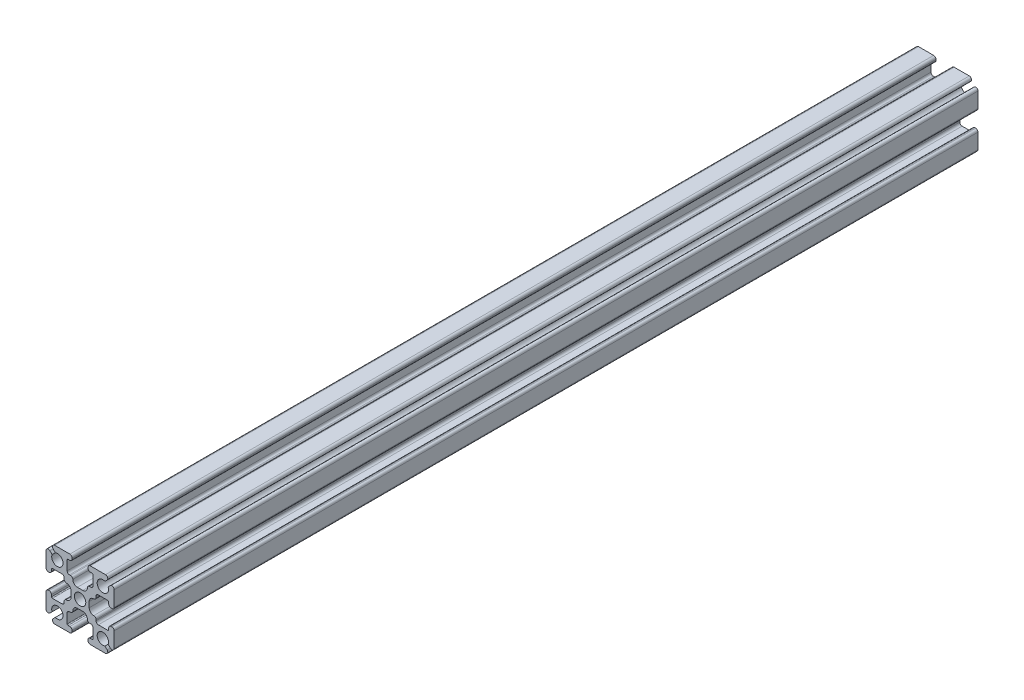
from build123d import *

# Parameters (mm, degrees)
SKETCH1_R           = 1.25
BOSS_EXTRUDE1_DEPTH = 190


with BuildPart() as part:
    # Sketch1 → Boss-Extrude1 (new body)
    with BuildSketch(Plane.XY):
        with BuildLine():
            Line((6.646446609, 5.939339828), (6.163645978, 5.456539197))
            ThreePointArc((6.163645978, 5.456539197), (4.116116524, 4.116116524), (5.456539197, 6.163645978))
            Line((5.456539197, 6.163645978), (5.939339828, 6.646446609))
            ThreePointArc((5.939339828, 6.646446609), (6.047726204, 7.191341716), (5.585786438, 7.5))
            Line((5.585786438, 7.5), (2.25, 7.5))
            ThreePointArc((2.25, 7.5), (1.896446609, 7.353553391), (1.75, 7))
            Line((1.75, 7), (1.75, 6.8))
            ThreePointArc((1.75, 6.8), (1.896446609, 6.446446609), (2.25, 6.3))
            Line((2.25, 6.3), (2.65, 6.3))
            ThreePointArc((2.65, 6.3), (2.791421356, 6.241421356), (2.85, 6.1))
            Line((2.85, 6.1), (2.85, 4))
            ThreePointArc((2.85, 4), (2.703553391, 3.646446609), (2.35, 3.5))
            Line((2.35, 3.5), (2.1, 3.5))
            ThreePointArc((2.1, 3.5), (1.746446609, 3.353553391), (1.6, 3))
            ThreePointArc((1.6, 3), (1.307106781, 2.292893219), (0.6, 2))
            Line((0.6, 2), (-0.6, 2))
            ThreePointArc((-0.6, 2), (-1.307106781, 2.292893219), (-1.6, 3))
            ThreePointArc((-1.6, 3), (-1.746446609, 3.353553391), (-2.1, 3.5))
            Line((-2.1, 3.5), (-2.35, 3.5))
            ThreePointArc((-2.35, 3.5), (-2.703553391, 3.646446609), (-2.85, 4))
            Line((-2.85, 4), (-2.85, 6.1))
            ThreePointArc((-2.85, 6.1), (-2.791421356, 6.241421356), (-2.65, 6.3))
            Line((-2.65, 6.3), (-2.25, 6.3))
            ThreePointArc((-2.25, 6.3), (-1.896446609, 6.446446609), (-1.75, 6.8))
            Line((-1.75, 6.8), (-1.75, 7))
            ThreePointArc((-1.75, 7), (-1.896446609, 7.353553391), (-2.25, 7.5))
            Line((-2.25, 7.5), (-5.585786438, 7.5))
            ThreePointArc((-5.585786438, 7.5), (-6.047726204, 7.191341716), (-5.939339828, 6.646446609))
            Line((-5.939339828, 6.646446609), (-5.456539197, 6.163645978))
            ThreePointArc((-5.456539197, 6.163645978), (-4.116116524, 4.116116524), (-6.163645978, 5.456539197))
            Line((-6.163645978, 5.456539197), (-6.646446609, 5.939339828))
            ThreePointArc((-6.646446609, 5.939339828), (-7.191341716, 6.047726204), (-7.5, 5.585786438))
            Line((-7.5, 5.585786438), (-7.5, 2.25))
            ThreePointArc((-7.5, 2.25), (-7.353553391, 1.896446609), (-7, 1.75))
            Line((-7, 1.75), (-6.8, 1.75))
            ThreePointArc((-6.8, 1.75), (-6.446446609, 1.896446609), (-6.3, 2.25))
            Line((-6.3, 2.25), (-6.3, 2.65))
            ThreePointArc((-6.3, 2.65), (-6.241421356, 2.791421356), (-6.1, 2.85))
            Line((-6.1, 2.85), (-4, 2.85))
            ThreePointArc((-4, 2.85), (-3.646446609, 2.703553391), (-3.5, 2.35))
            Line((-3.5, 2.35), (-3.5, 2.1))
            ThreePointArc((-3.5, 2.1), (-3.353553391, 1.746446609), (-3, 1.6))
            ThreePointArc((-3, 1.6), (-2.292893219, 1.307106781), (-2, 0.6))
            Line((-2, 0.6), (-2, -0.6))
            ThreePointArc((-2, -0.6), (-2.292893219, -1.307106781), (-3, -1.6))
            ThreePointArc((-3, -1.6), (-3.353553391, -1.746446609), (-3.5, -2.1))
            Line((-3.5, -2.1), (-3.5, -2.35))
            ThreePointArc((-3.5, -2.35), (-3.646446609, -2.703553391), (-4, -2.85))
            Line((-4, -2.85), (-6.1, -2.85))
            ThreePointArc((-6.1, -2.85), (-6.241421356, -2.791421356), (-6.3, -2.65))
            Line((-6.3, -2.65), (-6.3, -2.25))
            ThreePointArc((-6.3, -2.25), (-6.446446609, -1.896446609), (-6.8, -1.75))
            Line((-6.8, -1.75), (-7, -1.75))
            ThreePointArc((-7, -1.75), (-7.353553391, -1.896446609), (-7.5, -2.25))
            Line((-7.5, -2.25), (-7.5, -5.585786438))
            ThreePointArc((-7.5, -5.585786438), (-7.191341716, -6.047726204), (-6.646446609, -5.939339828))
            Line((-6.646446609, -5.939339828), (-6.163645978, -5.456539197))
            ThreePointArc((-6.163645978, -5.456539197), (-4.116116524, -4.116116524), (-5.456539197, -6.163645978))
            Line((-5.456539197, -6.163645978), (-5.939339828, -6.646446609))
            ThreePointArc((-5.939339828, -6.646446609), (-6.047726204, -7.191341716), (-5.585786438, -7.5))
            Line((-5.585786438, -7.5), (-2.25, -7.5))
            ThreePointArc((-2.25, -7.5), (-1.896446609, -7.353553391), (-1.75, -7))
            Line((-1.75, -7), (-1.75, -6.8))
            ThreePointArc((-1.75, -6.8), (-1.896446609, -6.446446609), (-2.25, -6.3))
            Line((-2.25, -6.3), (-2.65, -6.3))
            ThreePointArc((-2.65, -6.3), (-2.791421356, -6.241421356), (-2.85, -6.1))
            Line((-2.85, -6.1), (-2.85, -4))
            ThreePointArc((-2.85, -4), (-2.703553391, -3.646446609), (-2.35, -3.5))
            Line((-2.35, -3.5), (-2.1, -3.5))
            ThreePointArc((-2.1, -3.5), (-1.746446609, -3.353553391), (-1.6, -3))
            ThreePointArc((-1.6, -3), (-1.307106781, -2.292893219), (-0.6, -2))
            Line((-0.6, -2), (0.6, -2))
            ThreePointArc((0.6, -2), (1.307106781, -2.292893219), (1.6, -3))
            ThreePointArc((1.6, -3), (1.746446609, -3.353553391), (2.1, -3.5))
            Line((2.1, -3.5), (2.35, -3.5))
            ThreePointArc((2.35, -3.5), (2.703553391, -3.646446609), (2.85, -4))
            Line((2.85, -4), (2.85, -6.1))
            ThreePointArc((2.85, -6.1), (2.791421356, -6.241421356), (2.65, -6.3))
            Line((2.65, -6.3), (2.25, -6.3))
            ThreePointArc((2.25, -6.3), (1.896446609, -6.446446609), (1.75, -6.8))
            Line((1.75, -6.8), (1.75, -7))
            ThreePointArc((1.75, -7), (1.896446609, -7.353553391), (2.25, -7.5))
            Line((2.25, -7.5), (5.585786438, -7.5))
            ThreePointArc((5.585786438, -7.5), (6.047726204, -7.191341716), (5.939339828, -6.646446609))
            Line((5.939339828, -6.646446609), (5.456539197, -6.163645978))
            ThreePointArc((5.456539197, -6.163645978), (4.116116524, -4.116116524), (6.163645978, -5.456539197))
            Line((6.163645978, -5.456539197), (6.646446609, -5.939339828))
            ThreePointArc((6.646446609, -5.939339828), (7.191341716, -6.047726204), (7.5, -5.585786438))
            Line((7.5, -5.585786438), (7.5, -2.25))
            ThreePointArc((7.5, -2.25), (7.353553391, -1.896446609), (7, -1.75))
            Line((7, -1.75), (6.8, -1.75))
            ThreePointArc((6.8, -1.75), (6.446446609, -1.896446609), (6.3, -2.25))
            Line((6.3, -2.25), (6.3, -2.65))
            ThreePointArc((6.3, -2.65), (6.241421356, -2.791421356), (6.1, -2.85))
            Line((6.1, -2.85), (4, -2.85))
            ThreePointArc((4, -2.85), (3.646446609, -2.703553391), (3.5, -2.35))
            Line((3.5, -2.35), (3.5, -2.1))
            ThreePointArc((3.5, -2.1), (3.353553391, -1.746446609), (3, -1.6))
            ThreePointArc((3, -1.6), (2.292893219, -1.307106781), (2, -0.6))
            Line((2, -0.6), (2, 0.6))
            ThreePointArc((2, 0.6), (2.292893219, 1.307106781), (3, 1.6))
            ThreePointArc((3, 1.6), (3.353553391, 1.746446609), (3.5, 2.1))
            Line((3.5, 2.1), (3.5, 2.35))
            ThreePointArc((3.5, 2.35), (3.646446609, 2.703553391), (4, 2.85))
            Line((4, 2.85), (6.1, 2.85))
            ThreePointArc((6.1, 2.85), (6.241421356, 2.791421356), (6.3, 2.65))
            Line((6.3, 2.65), (6.3, 2.25))
            ThreePointArc((6.3, 2.25), (6.446446609, 1.896446609), (6.8, 1.75))
            Line((6.8, 1.75), (7, 1.75))
            ThreePointArc((7, 1.75), (7.353553391, 1.896446609), (7.5, 2.25))
            Line((7.5, 2.25), (7.5, 5.585786438))
            ThreePointArc((7.5, 5.585786438), (7.191341716, 6.047726204), (6.646446609, 5.939339828))
        make_face()
        with Locations(Location((0, 0, 0), (0, 0, 180))):
            Circle(SKETCH1_R, mode=Mode.SUBTRACT)
    extrude(amount=BOSS_EXTRUDE1_DEPTH)


solid = part.part
